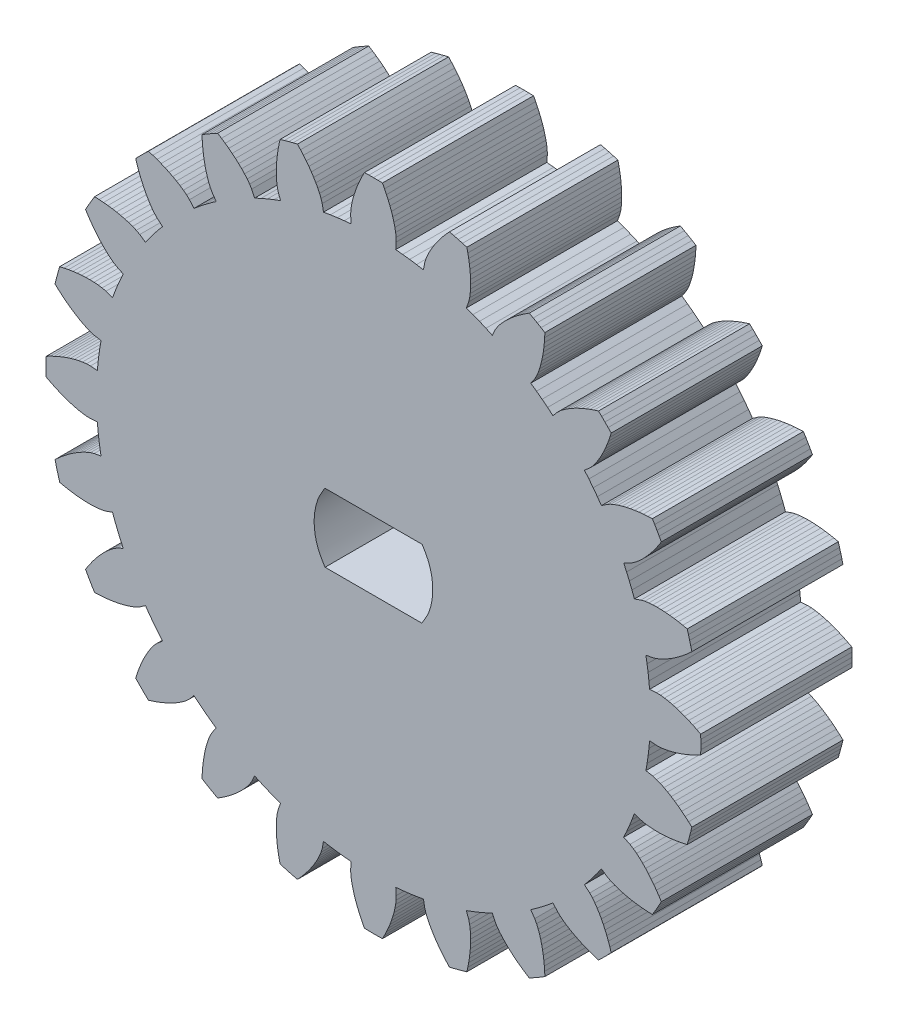
from build123d import *

# Parameters (mm, degrees)
BOSS_EXTRUDE1_DEPTH = 6


with BuildPart() as part:
    # Model → Boss-Extrude1 (new body)
    with BuildSketch(Plane.XY):
        Polygon((117.073257, 147.660672), (117.23085, 147.655761), (117.389543, 147.635977), (117.548914, 147.606146), (117.70868, 147.567877), (117.868756, 147.522072), (118.028974, 147.469353), (118.18922, 147.410115), (118.349381, 147.344668), (118.509373, 147.273265), (118.669082, 147.196078), (118.828397, 147.113274), (118.832094, 146.934429), (118.833223, 146.755557), (118.832094, 146.576684), (118.828397, 146.39784), (118.669082, 146.315036), (118.509373, 146.237848), (118.349381, 146.166446), (118.18922, 146.100999), (118.028974, 146.04176), (117.868756, 145.989041), (117.70868, 145.943237), (117.548914, 145.904967), (117.389543, 145.875136), (117.23085, 145.855353), (117.073257, 145.850442), (116.797836, 145.872625), (116.772013, 145.595821), (116.739218, 145.31978), (116.699453, 145.044641), (116.652746, 144.770603), (116.924526, 144.720735), (117.075486, 144.675212), (117.223653, 144.615014), (117.369844, 144.544938), (117.514285, 144.466622), (117.657033, 144.380967), (117.798144, 144.288568), (117.937619, 144.189875), (118.075371, 144.085198), (118.211431, 143.974821), (118.345712, 143.858941), (118.478215, 143.737726), (118.435487, 143.564019), (118.39036, 143.390904), (118.34289, 143.218438), (118.293021, 143.046649), (118.117705, 143.007928), (117.943461, 142.97471), (117.77043, 142.947137), (117.598783, 142.925378), (117.428659, 142.90963), (117.260257, 142.900176), (117.093802, 142.897353), (116.929549, 142.901756), (116.76792, 142.914174), (116.609509, 142.936131), (116.456008, 142.97217), (116.195715, 143.06488), (116.099138, 142.804192), (115.996014, 142.546043), (115.886399, 142.290576), (115.77035, 142.037958), (116.019947, 141.919453), (116.153974, 141.836395), (116.281539, 141.739932), (116.404616, 141.634409), (116.523855, 141.521351), (116.639566, 141.40166), (116.751947, 141.275902), (116.86111, 141.144471), (116.967113, 141.007706), (117.069955, 140.86589), (117.169664, 140.71919), (117.266268, 140.567835), (117.18005, 140.411088), (117.091658, 140.255556), (117.001149, 140.101265), (116.908524, 139.948216), (116.729143, 139.956174), (116.552246, 139.969213), (116.378002, 139.98736), (116.206552, 140.010756), (116.038178, 140.039571), (115.87305, 140.07403), (115.711534, 140.114388), (115.554026, 140.161152), (115.40109, 140.214972), (115.25377, 140.277202), (115.114832, 140.351737), (114.887389, 140.508653), (114.726664, 140.281859), (114.560209, 140.059186), (114.388223, 139.840802), (114.210761, 139.626821), (114.421186, 139.447751), (114.529136, 139.33283), (114.627378, 139.20662), (114.718959, 139.072847), (114.804867, 138.932808), (114.885668, 138.787238), (114.96167, 138.636673), (115.0331, 138.481479), (115.100072, 138.321938), (115.162697, 138.158306), (115.22106, 137.990807), (115.275191, 137.819611), (115.151352, 137.690523), (115.025734, 137.563156), (114.898368, 137.437539), (114.769279, 137.3137), (114.598083, 137.36783), (114.430584, 137.426193), (114.266952, 137.488818), (114.107412, 137.55579), (113.952218, 137.62722), (113.801652, 137.703223), (113.656082, 137.784023), (113.516043, 137.869931), (113.38227, 137.961512), (113.25606, 138.059754), (113.141139, 138.167704), (112.962069, 138.378129), (112.748088, 138.200668), (112.529705, 138.028681), (112.307031, 137.862227), (112.080238, 137.701501), (112.237153, 137.474058), (112.311688, 137.33512), (112.373918, 137.1878), (112.427738, 137.034864), (112.474502, 136.877356), (112.51486, 136.71584), (112.549319, 136.550712), (112.578134, 136.382338), (112.60153, 136.210888), (112.619677, 136.036644), (112.632716, 135.859747), (112.640674, 135.680367), (112.487625, 135.587741), (112.333334, 135.497233), (112.177802, 135.408841), (112.021056, 135.322622), (111.8697, 135.419226), (111.723001, 135.518936), (111.581184, 135.621777), (111.444419, 135.72778), (111.312988, 135.836944), (111.18723, 135.949324), (111.06754, 136.065036), (110.954481, 136.184274), (110.848958, 136.307352), (110.752495, 136.434916), (110.669437, 136.568943), (110.550932, 136.818541), (110.298315, 136.702491), (110.042847, 136.592876), (109.784698, 136.489752), (109.52401, 136.393175), (109.61672, 136.132882), (109.65276, 135.979381), (109.674716, 135.82097), (109.687134, 135.659341), (109.691537, 135.495088), (109.688715, 135.328633), (109.67926, 135.160231), (109.663512, 134.990108), (109.641753, 134.81846), (109.61418, 134.64543), (109.580962, 134.471186), (109.542241, 134.295869), (109.370453, 134.246), (109.197987, 134.198531), (109.024872, 134.153403), (108.851164, 134.110675), (108.729949, 134.243178), (108.614069, 134.37746), (108.503692, 134.513519), (108.399016, 134.651272), (108.300322, 134.790746), (108.207923, 134.931857), (108.122268, 135.074605), (108.043952, 135.219046), (107.973876, 135.365237), (107.913678, 135.513404), (107.868156, 135.664365), (107.818287, 135.936145), (107.544249, 135.889437), (107.269111, 135.849672), (106.993069, 135.816878), (106.716266, 135.791054), (106.738448, 135.515634), (106.733538, 135.358041), (106.713754, 135.199347), (106.683923, 135.039976), (106.645654, 134.88021), (106.599849, 134.720134), (106.54713, 134.559916), (106.487891, 134.39967), (106.422444, 134.239509), (106.351042, 134.079518), (106.273854, 133.919808), (106.19105, 133.760494), (106.012206, 133.756796), (105.833333, 133.755668), (105.654461, 133.756796), (105.475617, 133.760494), (105.392813, 133.919808), (105.315625, 134.079518), (105.244223, 134.239509), (105.178775, 134.39967), (105.119537, 134.559916), (105.066818, 134.720134), (105.021013, 134.88021), (104.982744, 135.039976), (104.952913, 135.199347), (104.933129, 135.358041), (104.928218, 135.515634), (104.950401, 135.791054), (104.673598, 135.816878), (104.397556, 135.849672), (104.122418, 135.889437), (103.84838, 135.936145), (103.798511, 135.664365), (103.752989, 135.513404), (103.692791, 135.365237), (103.622715, 135.219046), (103.544398, 135.074605), (103.458744, 134.931857), (103.366344, 134.790746), (103.267651, 134.651272), (103.162975, 134.513519), (103.052598, 134.37746), (102.936717, 134.243178), (102.815503, 134.110675), (102.641795, 134.153403), (102.46868, 134.198531), (102.296214, 134.246), (102.124425, 134.295869), (102.085704, 134.471186), (102.052487, 134.64543), (102.024914, 134.81846), (102.003154, 134.990108), (101.987406, 135.160231), (101.977952, 135.328633), (101.97513, 135.495088), (101.979532, 135.659341), (101.99195, 135.82097), (102.013907, 135.979381), (102.049947, 136.132882), (102.142657, 136.393175), (101.881968, 136.489752), (101.62382, 136.592876), (101.368352, 136.702491), (101.115735, 136.818541), (100.99723, 136.568943), (100.914172, 136.434916), (100.817708, 136.307352), (100.712185, 136.184274), (100.599127, 136.065036), (100.479437, 135.949324), (100.353678, 135.836944), (100.222248, 135.72778), (100.085483, 135.621777), (99.943666, 135.518936), (99.796967, 135.419226), (99.645611, 135.322622), (99.488865, 135.408841), (99.333332, 135.497233), (99.179041, 135.587741), (99.025992, 135.680367), (99.033951, 135.859747), (99.04699, 136.036644), (99.065136, 136.210888), (99.088533, 136.382338), (99.117348, 136.550712), (99.151807, 136.71584), (99.192165, 136.877356), (99.238929, 137.034864), (99.292749, 137.1878), (99.354979, 137.33512), (99.429514, 137.474058), (99.586429, 137.701501), (99.359635, 137.862227), (99.136962, 138.028681), (98.918578, 138.200668), (98.704598, 138.378129), (98.525528, 138.167704), (98.410607, 138.059754), (98.284397, 137.961512), (98.150624, 137.869931), (98.010585, 137.784023), (97.865015, 137.703223), (97.714449, 137.62722), (97.559255, 137.55579), (97.399715, 137.488818), (97.236082, 137.426193), (97.068584, 137.36783), (96.897388, 137.3137), (96.768299, 137.437539), (96.640932, 137.563156), (96.515315, 137.690523), (96.391476, 137.819611), (96.445606, 137.990807), (96.50397, 138.158306), (96.566595, 138.321938), (96.633566, 138.481479), (96.704997, 138.636673), (96.780999, 138.787238), (96.861799, 138.932808), (96.947708, 139.072847), (97.039289, 139.20662), (97.13753, 139.33283), (97.24548, 139.447751), (97.455905, 139.626821), (97.278444, 139.840802), (97.106458, 140.059186), (96.940003, 140.281859), (96.779278, 140.508653), (96.551835, 140.351737), (96.412897, 140.277202), (96.265577, 140.214972), (96.11264, 140.161152), (95.955132, 140.114388), (95.793616, 140.07403), (95.628488, 140.039571), (95.460114, 140.010756), (95.288664, 139.98736), (95.11442, 139.969213), (94.937524, 139.956174), (94.758143, 139.948216), (94.665518, 140.101265), (94.575009, 140.255556), (94.486617, 140.411088), (94.400398, 140.567835), (94.497003, 140.71919), (94.596712, 140.86589), (94.699554, 141.007706), (94.805556, 141.144471), (94.91472, 141.275902), (95.027101, 141.40166), (95.142812, 141.521351), (95.262051, 141.634409), (95.385128, 141.739932), (95.512692, 141.836395), (95.64672, 141.919453), (95.896317, 142.037958), (95.780267, 142.290576), (95.670652, 142.546043), (95.567528, 142.804192), (95.470952, 143.06488), (95.210658, 142.97217), (95.057158, 142.936131), (94.898746, 142.914174), (94.737118, 142.901756), (94.572864, 142.897353), (94.40641, 142.900176), (94.238008, 142.90963), (94.067884, 142.925378), (93.896236, 142.947137), (93.723206, 142.97471), (93.548962, 143.007928), (93.373646, 143.046649), (93.323777, 143.218438), (93.276307, 143.390904), (93.23118, 143.564019), (93.188451, 143.737726), (93.320955, 143.858941), (93.455236, 143.974821), (93.591295, 144.085198), (93.729048, 144.189875), (93.868522, 144.288568), (94.009633, 144.380967), (94.152381, 144.466622), (94.296823, 144.544938), (94.443014, 144.615014), (94.59118, 144.675212), (94.742141, 144.720735), (95.013921, 144.770603), (94.967213, 145.044641), (94.927448, 145.31978), (94.894654, 145.595821), (94.868831, 145.872625), (94.59341, 145.850442), (94.435817, 145.855353), (94.277124, 145.875136), (94.117753, 145.904967), (93.957987, 145.943237), (93.79791, 145.989041), (93.637693, 146.04176), (93.477447, 146.100999), (93.317286, 146.166446), (93.157294, 146.237848), (92.997584, 146.315036), (92.83827, 146.39784), (92.834573, 146.576684), (92.833444, 146.755557), (92.834573, 146.934429), (92.83827, 147.113274), (92.997584, 147.196078), (93.157294, 147.273265), (93.317286, 147.344668), (93.477447, 147.410115), (93.637693, 147.469353), (93.79791, 147.522072), (93.957987, 147.567877), (94.117753, 147.606146), (94.277124, 147.635977), (94.435817, 147.655761), (94.59341, 147.660672), (94.868831, 147.638489), (94.894654, 147.915293), (94.927448, 148.191334), (94.967213, 148.466473), (95.013921, 148.74051), (94.742141, 148.790379), (94.59118, 148.835902), (94.443014, 148.8961), (94.296823, 148.966175), (94.152381, 149.044492), (94.009633, 149.130146), (93.868522, 149.222546), (93.729048, 149.321239), (93.591295, 149.425915), (93.455236, 149.536292), (93.320955, 149.652173), (93.188451, 149.773387), (93.23118, 149.947095), (93.276307, 150.12021), (93.323777, 150.292676), (93.373646, 150.464465), (93.548962, 150.503186), (93.723206, 150.536403), (93.896236, 150.563976), (94.067884, 150.585736), (94.238008, 150.601484), (94.40641, 150.610938), (94.572864, 150.61376), (94.737118, 150.609358), (94.898746, 150.59694), (95.057158, 150.574983), (95.210658, 150.538943), (95.470952, 150.446233), (95.567528, 150.706922), (95.670652, 150.965071), (95.780267, 151.220538), (95.896317, 151.473155), (95.64672, 151.59166), (95.512692, 151.674718), (95.385128, 151.771182), (95.262051, 151.876705), (95.142812, 151.989763), (95.027101, 152.109454), (94.91472, 152.235212), (94.805556, 152.366643), (94.699554, 152.503408), (94.596712, 152.645224), (94.497003, 152.791923), (94.400398, 152.943279), (94.486617, 153.100025), (94.575009, 153.255558), (94.665518, 153.409849), (94.758143, 153.562898), (94.937524, 153.554939), (95.11442, 153.541901), (95.288664, 153.523754), (95.460114, 153.500358), (95.628488, 153.471543), (95.793616, 153.437083), (95.955132, 153.396726), (96.11264, 153.349961), (96.265577, 153.296142), (96.412897, 153.233912), (96.551835, 153.159377), (96.779278, 153.002461), (96.940003, 153.229255), (97.106458, 153.451928), (97.278444, 153.670312), (97.455905, 153.884293), (97.24548, 154.063363), (97.13753, 154.178284), (97.039289, 154.304493), (96.947708, 154.438267), (96.861799, 154.578305), (96.780999, 154.723876), (96.704997, 154.874441), (96.633566, 155.029635), (96.566595, 155.189175), (96.50397, 155.352808), (96.445606, 155.520307), (96.391476, 155.691503), (96.515315, 155.820591), (96.640932, 155.947958), (96.768299, 156.073575), (96.897388, 156.197414), (97.068584, 156.143284), (97.236082, 156.08492), (97.399715, 156.022295), (97.559255, 155.955324), (97.714449, 155.883894), (97.865015, 155.807891), (98.010585, 155.727091), (98.150624, 155.641182), (98.284397, 155.549601), (98.410607, 155.45136), (98.525528, 155.34341), (98.704598, 155.132985), (98.918578, 155.310446), (99.136962, 155.482432), (99.359635, 155.648887), (99.586429, 155.809613), (99.429514, 156.037056), (99.354979, 156.175994), (99.292749, 156.323314), (99.238929, 156.47625), (99.192165, 156.633758), (99.151807, 156.795274), (99.117348, 156.960402), (99.088533, 157.128776), (99.065136, 157.300226), (99.04699, 157.47447), (99.033951, 157.651367), (99.025992, 157.830747), (99.179041, 157.923372), (99.333332, 158.013881), (99.488865, 158.102273), (99.645611, 158.188492), (99.796967, 158.091887), (99.943666, 157.992178), (100.085483, 157.889336), (100.222248, 157.783334), (100.353678, 157.67417), (100.479437, 157.561789), (100.599127, 157.446078), (100.712185, 157.326839), (100.817708, 157.203762), (100.914172, 157.076198), (100.99723, 156.94217), (101.115735, 156.692573), (101.368352, 156.808623), (101.62382, 156.918238), (101.881968, 157.021362), (102.142657, 157.117938), (102.049947, 157.378232), (102.013907, 157.531733), (101.99195, 157.690144), (101.979532, 157.851773), (101.97513, 158.016026), (101.977952, 158.182481), (101.987406, 158.350883), (102.003154, 158.521006), (102.024914, 158.692654), (102.052487, 158.865684), (102.085704, 159.039928), (102.124425, 159.215245), (102.296214, 159.265113), (102.46868, 159.312583), (102.641795, 159.35771), (102.815503, 159.400439), (102.936717, 159.267936), (103.052598, 159.133654), (103.162975, 158.997595), (103.267651, 158.859842), (103.366344, 158.720368), (103.458744, 158.579257), (103.544398, 158.436509), (103.622715, 158.292068), (103.692791, 158.145876), (103.752989, 157.99771), (103.798511, 157.846749), (103.84838, 157.574969), (104.122418, 157.621677), (104.397556, 157.661442), (104.673598, 157.694236), (104.950401, 157.72006), (104.928218, 157.99548), (104.933129, 158.153073), (104.952913, 158.311767), (104.982744, 158.471138), (105.021013, 158.630904), (105.066818, 158.79098), (105.119537, 158.951198), (105.178775, 159.111443), (105.244223, 159.271604), (105.315625, 159.431596), (105.392813, 159.591306), (105.475617, 159.75062), (105.654461, 159.754317), (105.833333, 159.755446), (106.012206, 159.754317), (106.19105, 159.75062), (106.273854, 159.591306), (106.351042, 159.431596), (106.422444, 159.271604), (106.487891, 159.111443), (106.54713, 158.951198), (106.599849, 158.79098), (106.645654, 158.630904), (106.683923, 158.471138), (106.713754, 158.311767), (106.733538, 158.153073), (106.738448, 157.99548), (106.716266, 157.72006), (106.993069, 157.694236), (107.269111, 157.661442), (107.544249, 157.621677), (107.818287, 157.574969), (107.868156, 157.846749), (107.913678, 157.99771), (107.973876, 158.145876), (108.043952, 158.292068), (108.122268, 158.436509), (108.207923, 158.579257), (108.300322, 158.720368), (108.399016, 158.859842), (108.503692, 158.997595), (108.614069, 159.133654), (108.729949, 159.267936), (108.851164, 159.400439), (109.024872, 159.35771), (109.197987, 159.312583), (109.370453, 159.265113), (109.542241, 159.215245), (109.580962, 159.039928), (109.61418, 158.865684), (109.641753, 158.692654), (109.663512, 158.521006), (109.67926, 158.350883), (109.688715, 158.182481), (109.691537, 158.016026), (109.687134, 157.851773), (109.674716, 157.690144), (109.65276, 157.531733), (109.61672, 157.378232), (109.52401, 157.117938), (109.784698, 157.021362), (110.042847, 156.918238), (110.298315, 156.808623), (110.550932, 156.692573), (110.669437, 156.94217), (110.752495, 157.076198), (110.848958, 157.203762), (110.954481, 157.326839), (111.06754, 157.446078), (111.18723, 157.561789), (111.312988, 157.67417), (111.444419, 157.783334), (111.581184, 157.889336), (111.723001, 157.992178), (111.8697, 158.091887), (112.021056, 158.188492), (112.177802, 158.102273), (112.333334, 158.013881), (112.487625, 157.923372), (112.640674, 157.830747), (112.632716, 157.651367), (112.619677, 157.47447), (112.60153, 157.300226), (112.578134, 157.128776), (112.549319, 156.960402), (112.51486, 156.795274), (112.474502, 156.633758), (112.427738, 156.47625), (112.373918, 156.323314), (112.311688, 156.175994), (112.237153, 156.037056), (112.080238, 155.809613), (112.307031, 155.648887), (112.529705, 155.482432), (112.748088, 155.310446), (112.962069, 155.132985), (113.141139, 155.34341), (113.25606, 155.45136), (113.38227, 155.549601), (113.516043, 155.641182), (113.656082, 155.727091), (113.801652, 155.807891), (113.952218, 155.883894), (114.107412, 155.955324), (114.266952, 156.022295), (114.430584, 156.08492), (114.598083, 156.143284), (114.769279, 156.197414), (114.898368, 156.073575), (115.025734, 155.947958), (115.151352, 155.820591), (115.275191, 155.691503), (115.22106, 155.520307), (115.162697, 155.352808), (115.100072, 155.189175), (115.0331, 155.029635), (114.96167, 154.874441), (114.885668, 154.723876), (114.804867, 154.578305), (114.718959, 154.438267), (114.627378, 154.304493), (114.529136, 154.178284), (114.421186, 154.063363), (114.210761, 153.884293), (114.388223, 153.670312), (114.560209, 153.451928), (114.726664, 153.229255), (114.887389, 153.002461), (115.114832, 153.159377), (115.25377, 153.233912), (115.40109, 153.296142), (115.554026, 153.349961), (115.711534, 153.396726), (115.87305, 153.437083), (116.038178, 153.471543), (116.206552, 153.500358), (116.378002, 153.523754), (116.552246, 153.541901), (116.729143, 153.554939), (116.908524, 153.562898), (117.001149, 153.409849), (117.091658, 153.255558), (117.18005, 153.100025), (117.266268, 152.943279), (117.169664, 152.791923), (117.069955, 152.645224), (116.967113, 152.503408), (116.86111, 152.366643), (116.751947, 152.235212), (116.639566, 152.109454), (116.523855, 151.989763), (116.404616, 151.876705), (116.281539, 151.771182), (116.153974, 151.674718), (116.019947, 151.59166), (115.77035, 151.473155), (115.886399, 151.220538), (115.996014, 150.965071), (116.099138, 150.706922), (116.195715, 150.446233), (116.456008, 150.538943), (116.609509, 150.574983), (116.76792, 150.59694), (116.929549, 150.609358), (117.093802, 150.61376), (117.260257, 150.610938), (117.428659, 150.601484), (117.598783, 150.585736), (117.77043, 150.563976), (117.943461, 150.536403), (118.117705, 150.503186), (118.293021, 150.464465), (118.34289, 150.292676), (118.39036, 150.12021), (118.435487, 149.947095), (118.478215, 149.773387), (118.345712, 149.652173), (118.211431, 149.536292), (118.075371, 149.425915), (117.937619, 149.321239), (117.798144, 149.222546), (117.657033, 149.130146), (117.514285, 149.044492), (117.369844, 148.966175), (117.223653, 148.8961), (117.075486, 148.835902), (116.924526, 148.790379), (116.652746, 148.74051), (116.699453, 148.466473), (116.739218, 148.191334), (116.772013, 147.915293), (116.797836, 147.638489), align=None)
        with BuildLine():
            Line((103.910694, 145.39375), (107.755972, 145.39375))
            add(Edge.make_bspline(
                [(107.755972, 145.39375), (107.839884981, 145.527538857), (108.008863448, 145.796954094), (108.153815286, 146.261973972), (108.205411527, 146.7514268), (108.154370947, 147.240796558), (108.013940495, 147.705958526), (107.847332176, 147.976238421), (107.764792, 148.110139)],
                knots=[0, 0, 0, 0, 0.163458154, 0.329161325, 0.500565269, 0.671400436, 0.837207012, 1, 1, 1, 1], degree=3))
            Line((107.764792, 148.110139), (103.901875, 148.110139))
            add(Edge.make_bspline(
                [(103.901875, 148.110139), (103.819334321, 147.976238498), (103.652725128, 147.705958983), (103.51229631, 147.240796302), (103.461255835, 146.751426946), (103.512850027, 146.261973651), (103.65780403, 145.796954564), (103.826781557, 145.527538936), (103.910694, 145.39375)],
                knots=[0, 0, 0, 0, 0.162793162, 0.32859964, 0.499434814, 0.670838728, 0.836542012, 1, 1, 1, 1], degree=3))
        make_face(mode=Mode.SUBTRACT)
    extrude(amount=BOSS_EXTRUDE1_DEPTH)


solid = part.part
